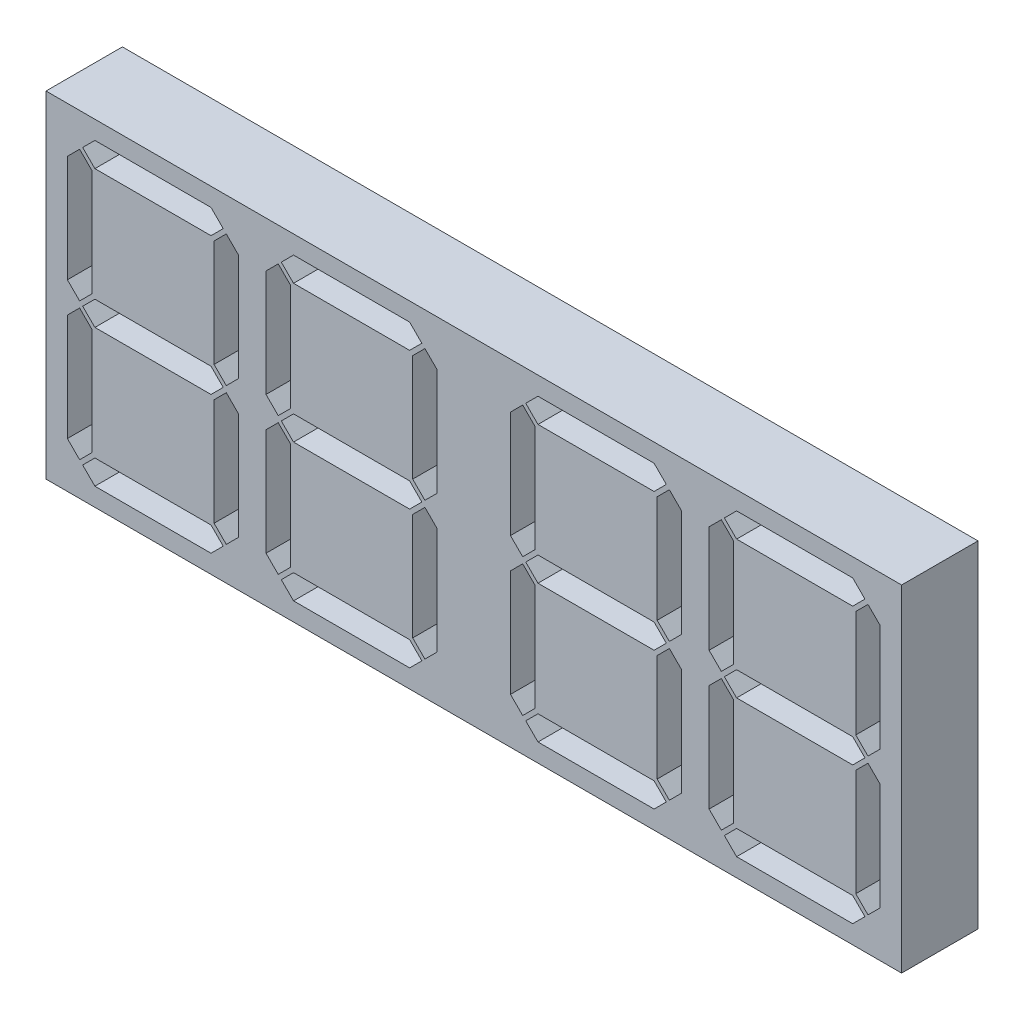
from build123d import *

# Parameters (mm, degrees)
SKETCH1_W            = 140
SKETCH1_H            = 110
BOSS_EXTRUDE1_DEPTH  = 25
SKETCH2_W            = 60.4
SKETCH2_H            = 100.4
CUT_EXTRUDE1_DEPTH   = 1.6
FILLET1_R            = 3
CUT_EXTRUDE4_DEPTH   = 180.57605631
CUT_EXTRUDE5_DEPTH   = 180.57605631
SKETCH7_W            = 34
SKETCH7_H            = 31
CUT_EXTRUDE6_DEPTH   = 1
SKETCH3_R            = 2
CUT_EXTRUDE7_DEPTH   = 3.5
FILLET1_OF_MIRROR1_R = 3


with BuildPart() as part:
    # Sketch1 → Boss-Extrude1 (new body)
    with BuildSketch(Plane.XY):
        with Locations((70, 55)):
            Rectangle(SKETCH1_W, SKETCH1_H)
    boss_extrude1 = extrude(amount=BOSS_EXTRUDE1_DEPTH)

    # Sketch2 → Cut-Extrude1 (cut)
    with BuildSketch(Plane(origin=(0, 0, 0), x_dir=(-1, 0, 0), z_dir=(0, 0, -1))):
        with Locations((-105, 55)):
            Rectangle(SKETCH2_W, SKETCH2_H)
        with Locations((-40, 55)):
            Rectangle(SKETCH2_W, SKETCH2_H)
    cut_extrude1 = extrude(amount=-CUT_EXTRUDE1_DEPTH, mode=Mode.SUBTRACT)

    # Fillet1
    fillet1_edges = [part.edges().sort_by_distance(p)[0] for p in [
        (74.8, 105.2, 0.8),
        (74.8, 4.8, 0.8),
        (135.2, 4.8, 0.8),
        (135.2, 105.2, 0.8),
        (70.2, 4.8, 0.8),
        (9.8, 4.8, 0.8),
        (9.8, 105.2, 0.8),
        (70.2, 105.2, 0.8),
    ]]
    fillet(fillet1_edges, radius=FILLET1_R)

    # Sketch5 → Cut-Extrude4 (cut, through all)
    with BuildSketch(Plane(origin=(0, 0, 1.6), x_dir=(-1, 0, 0), z_dir=(0, 0, -1))):
        Polygon((-21, 14), (-59, 14), (-63, 10), (-59, 6), (-21, 6), (-17, 10), align=None)
        Polygon((-86, 14), (-124, 14), (-128, 10), (-124, 6), (-86, 6), (-82, 10), align=None)
        Polygon((-82, 55), (-86, 59), (-124, 59), (-128, 55), (-124, 51), (-86, 51), align=None)
        Polygon((-82, 100), (-86, 104), (-124, 104), (-128, 100), (-124, 96), (-86, 96), align=None)
        Polygon((-17, 55), (-21, 59), (-59, 59), (-63, 55), (-59, 51), (-21, 51), align=None)
        Polygon((-17, 100), (-21, 104), (-59, 104), (-63, 100), (-59, 96), (-21, 96), align=None)
    cut_extrude4 = extrude(amount=-CUT_EXTRUDE4_DEPTH, mode=Mode.SUBTRACT)

    # Sketch6 → Cut-Extrude5 (cut, through all)
    with BuildSketch(Plane(origin=(0, 0, 1.6), x_dir=(-1, 0, 0), z_dir=(0, 0, -1))):
        Polygon((-64, 11), (-60, 15), (-60, 50), (-64, 54), (-68, 50), (-68, 15), align=None)
        Polygon((-129, 11), (-125, 15), (-125, 50), (-129, 54), (-133, 50), (-133, 15), align=None)
        Polygon((-81, 54), (-85, 50), (-85, 15), (-81, 11), (-77, 15), (-77, 50), align=None)
        Polygon((-129, 99), (-133, 95), (-133, 60), (-129, 56), (-125, 60), (-125, 95), align=None)
        Polygon((-81, 99), (-85, 95), (-85, 60), (-81, 56), (-77, 60), (-77, 95), align=None)
        Polygon((-16, 54), (-20, 50), (-20, 15), (-16, 11), (-12, 15), (-12, 50), align=None)
        Polygon((-64, 99), (-68, 95), (-68, 60), (-64, 56), (-60, 60), (-60, 95), align=None)
        Polygon((-16, 99), (-20, 95), (-20, 60), (-16, 56), (-12, 60), (-12, 95), align=None)
    cut_extrude5 = extrude(amount=-CUT_EXTRUDE5_DEPTH, mode=Mode.SUBTRACT)

    # Sketch7 → Cut-Extrude6 (cut)
    # profile 1 of 8: a face of its own
    with BuildSketch(Plane(origin=(0, 0, 1.6), x_dir=(-1, 0, 0), z_dir=(0, 0, -1))):
        Polygon((-124, 96), (-125, 95), (-125, 60), (-124, 59), (-86, 59), (-85, 60), (-85, 95), (-86, 96), align=None)
        with Locations((-105, 77.5)):
            Rectangle(SKETCH7_W, SKETCH7_H, mode=Mode.SUBTRACT)
    # profile 2 of 8: a face of its own
    with BuildSketch(Plane(origin=(0, 0, 1.6), x_dir=(-1, 0, 0), z_dir=(0, 0, -1))):
        Polygon((-125, 15), (-124, 14), (-86, 14), (-85, 15), (-85, 50), (-86, 51), (-124, 51), (-125, 50), align=None)
        with Locations((-105, 32.5)):
            Rectangle(SKETCH7_W, SKETCH7_H, mode=Mode.SUBTRACT)
    # profile 3 of 8: a face of its own
    with BuildSketch(Plane(origin=(0, 0, 1.6), x_dir=(-1, 0, 0), z_dir=(0, 0, -1))):
        Polygon((-59, 96), (-60, 95), (-60, 60), (-59, 59), (-21, 59), (-20, 60), (-20, 95), (-21, 96), align=None)
        with Locations((-40, 77.5)):
            Rectangle(SKETCH7_W, SKETCH7_H, mode=Mode.SUBTRACT)
    # profile 4 of 8: a face of its own
    with BuildSketch(Plane(origin=(0, 0, 1.6), x_dir=(-1, 0, 0), z_dir=(0, 0, -1))):
        Polygon((-59, 51), (-60, 50), (-60, 15), (-59, 14), (-21, 14), (-20, 15), (-20, 50), (-21, 51), align=None)
        with Locations((-40, 32.5)):
            Rectangle(SKETCH7_W, SKETCH7_H, mode=Mode.SUBTRACT)
    # profile 5 of 8: a face of its own
    with BuildSketch(Plane(origin=(0, 0, 1.6), x_dir=(-1, 0, 0), z_dir=(0, 0, -1))):
        Polygon((-15, 55), (-11, 51), (-9.8, 51), (-9.8, 59), (-11, 59), align=None)
    # profile 6 of 8: a face of its own
    with BuildSketch(Plane(origin=(0, 0, 1.6), x_dir=(-1, 0, 0), z_dir=(0, 0, -1))):
        Polygon((-80, 55), (-76, 51), (-74.8, 51), (-74.8, 59), (-76, 59), align=None)
    # profile 7 of 8: a face of its own
    with BuildSketch(Plane(origin=(0, 0, 1.6), x_dir=(-1, 0, 0), z_dir=(0, 0, -1))):
        Polygon((-65, 55), (-69, 59), (-70.2, 59), (-70.2, 51), (-69, 51), align=None)
    # profile 8 of 8: a face of its own
    with BuildSketch(Plane(origin=(0, 0, 1.6), x_dir=(-1, 0, 0), z_dir=(0, 0, -1))):
        Polygon((-130, 55), (-134, 59), (-135.2, 59), (-135.2, 51), (-134, 51), align=None)
    cut_extrude6 = extrude(amount=-CUT_EXTRUDE6_DEPTH, mode=Mode.SUBTRACT)

    # Sketch3 → Cut-Extrude7 (cut)
    with BuildSketch(Plane(origin=(0, 0, 1.6), x_dir=(-1, 0, 0), z_dir=(0, 0, -1))):
        with Locations((-131.5, 101.5)):
            Circle(SKETCH3_R)
        with Locations((-131.5, 8.5)):
            Circle(SKETCH3_R)
        with Locations((-78.5, 8.5)):
            Circle(SKETCH3_R)
        with Locations((-78.5, 101.5)):
            Circle(SKETCH3_R)
        with Locations((-66.5, 101.5)):
            Circle(SKETCH3_R)
        with Locations((-66.5, 8.5)):
            Circle(SKETCH3_R)
        with Locations((-13.5, 8.5)):
            Circle(SKETCH3_R)
        with Locations((-13.5, 101.5)):
            Circle(SKETCH3_R)
    cut_extrude7 = extrude(amount=-CUT_EXTRUDE7_DEPTH, mode=Mode.SUBTRACT)

    # Mirror1: Boss-Extrude1, Cut-Extrude1, Cut-Extrude4, Cut-Extrude5, Cut-Extrude6, Cut-Extrude7 across plane
    add(boss_extrude1.mirror(Plane(origin=(0, 0, 25), x_dir=(0, 0, 1), z_dir=(1, 0, 0))))
    add(cut_extrude1.mirror(Plane(origin=(0, 0, 25), x_dir=(0, 0, 1), z_dir=(1, 0, 0))), mode=Mode.SUBTRACT)
    add(cut_extrude4.mirror(Plane(origin=(0, 0, 25), x_dir=(0, 0, 1), z_dir=(1, 0, 0))), mode=Mode.SUBTRACT)
    add(cut_extrude5.mirror(Plane(origin=(0, 0, 25), x_dir=(0, 0, 1), z_dir=(1, 0, 0))), mode=Mode.SUBTRACT)
    add(cut_extrude6.mirror(Plane(origin=(0, 0, 25), x_dir=(0, 0, 1), z_dir=(1, 0, 0))), mode=Mode.SUBTRACT)
    add(cut_extrude7.mirror(Plane(origin=(0, 0, 25), x_dir=(0, 0, 1), z_dir=(1, 0, 0))), mode=Mode.SUBTRACT)

    # Fillet1 of Mirror1
    fillet1_of_mirror1_edges = [part.edges().sort_by_distance(p)[0] for p in [
        (-74.8, 105.2, 0.8),
        (-74.8, 4.8, 0.8),
        (-135.2, 4.8, 0.8),
        (-135.2, 105.2, 0.8),
        (-70.2, 4.8, 0.8),
        (-9.8, 4.8, 0.8),
        (-9.8, 105.2, 0.8),
        (-70.2, 105.2, 0.8),
    ]]
    fillet(fillet1_of_mirror1_edges, radius=FILLET1_OF_MIRROR1_R)


solid = part.part
